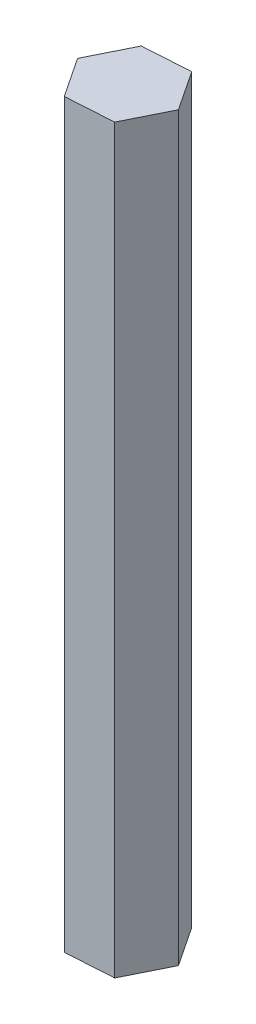
from build123d import *

# Parameters (mm, degrees)
BOSS_EXTRUDE1_DEPTH = 114.3


with BuildPart() as part:
    # Sketch1 → Boss-Extrude1 (new body)
    with BuildSketch(Plane(origin=(0, 0, 0), x_dir=(1, 0, 0), z_dir=(0, 1, 0))):
        Polygon((3.259935789, 6.567811811), (-4.057923981, 6.107093114), (-7.31785977, -0.460718697), (-3.259935789, -6.567811811), (4.057923981, -6.107093114), (7.31785977, 0.460718697), align=None)
    extrude(amount=BOSS_EXTRUDE1_DEPTH)


solid = part.part
